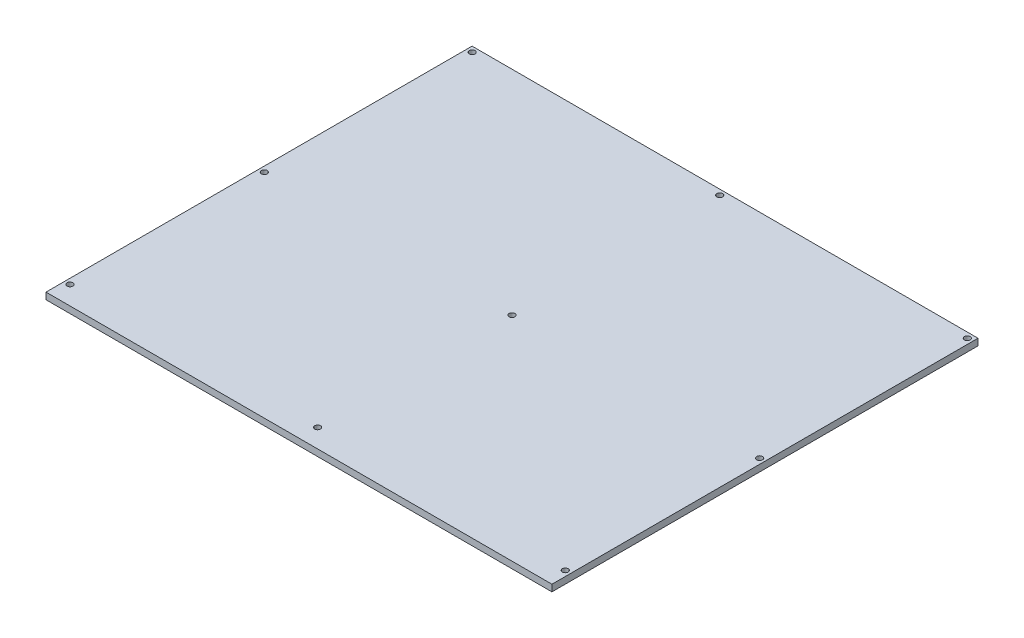
from build123d import *

# Parameters (mm, degrees)
SKETCH1_W           = 380
SKETCH1_H           = 320
BOSS_EXTRUDE1_DEPTH = 5
SKETCH2_R           = 2.2
CUT_EXTRUDE1_DEPTH  = 5


with BuildPart() as part:
    # Sketch1 → Boss-Extrude1 (new body)
    with BuildSketch(Plane(origin=(0, 0, 0), x_dir=(1, 0, 0), z_dir=(0, 1, 0))):
        with Locations((190, 160)):
            Rectangle(SKETCH1_W, SKETCH1_H)
    extrude(amount=BOSS_EXTRUDE1_DEPTH)

    # Sketch2 → Cut-Extrude1 (cut)
    with BuildSketch(Plane(origin=(0, 5, 0), x_dir=(1, 0, 0), z_dir=(0, 1, 0))):
        with Locations(Location((4, 316, 0), (0, 0, 270))):
            Circle(SKETCH2_R)
        with Locations(Location((4, 160, 0), (0, 0, 270))):
            Circle(SKETCH2_R)
        with Locations(Location((4, 14, 0), (0, 0, 270))):
            Circle(SKETCH2_R)
        with Locations(Location((376, 160, 0), (0, 0, 90))):
            Circle(SKETCH2_R)
        with Locations(Location((376, 14, 0), (0, 0, 90))):
            Circle(SKETCH2_R)
        with Locations(Location((376, 316, 0), (0, 0, 90))):
            Circle(SKETCH2_R)
        with Locations(Location((190, 160, 0), (0, 0, 270))):
            Circle(SKETCH2_R)
        with Locations(Location((190, 14, 0), (0, 0, 270))):
            Circle(SKETCH2_R)
        with Locations(Location((190, 316, 0), (0, 0, 270))):
            Circle(SKETCH2_R)
    extrude(amount=-CUT_EXTRUDE1_DEPTH, mode=Mode.SUBTRACT)


solid = part.part
